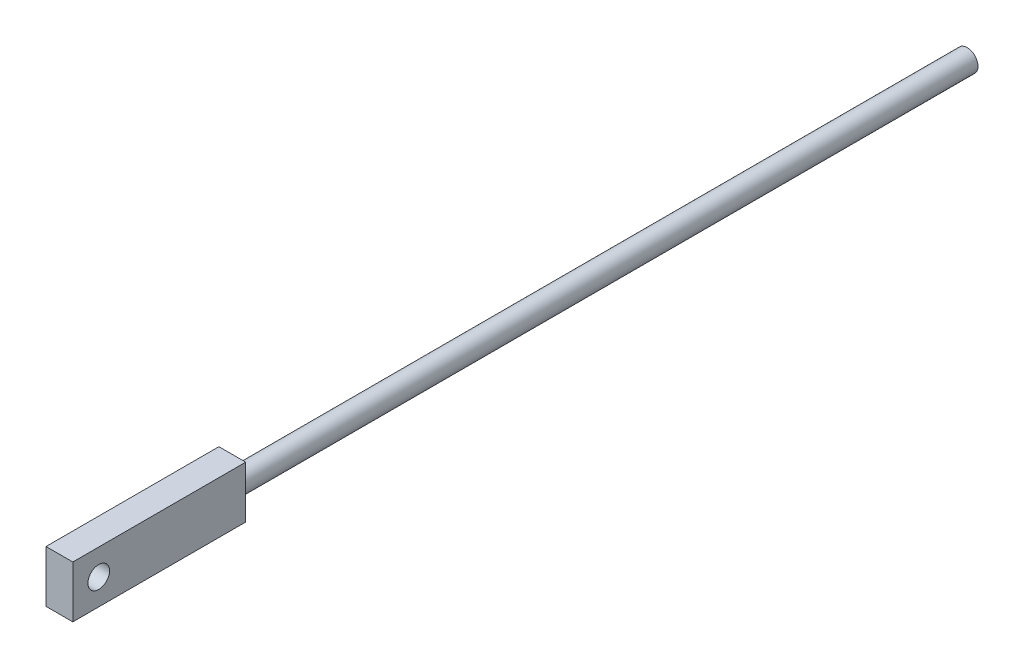
from build123d import *

# Parameters (mm, degrees)
SKETCH_1_W          = 6.2
SKETCH_1_H          = 12
EXTRUDE_1_DEPTH     = 40
SKETCH_2_R          = 2.5
CUT_EXTRUDE_1_DEPTH = 41.919921799
SKETCH_3_R          = 2.5
EXTRUDE_2_DEPTH     = 170


with BuildPart() as part:
    # 草图1 → 凸台-拉伸1 (new body)
    with BuildSketch(Plane.XY):
        Rectangle(SKETCH_1_W, SKETCH_1_H)
    extrude(amount=EXTRUDE_1_DEPTH)

    # 草图2 → 切除-拉伸1 (cut, through all)
    with BuildSketch(Plane(origin=(3.1, 0, 0), x_dir=(0, 0, -1), z_dir=(1, 0, 0))):
        with Locations((-34, 0)):
            Circle(SKETCH_2_R)
    extrude(amount=-CUT_EXTRUDE_1_DEPTH, mode=Mode.SUBTRACT)

    # 草图3 → 凸台-拉伸2 (add)
    with BuildSketch(Plane(origin=(0, 0, 0), x_dir=(-1, 0, 0), z_dir=(0, 0, -1))):
        Circle(SKETCH_3_R)
    extrude(amount=EXTRUDE_2_DEPTH)


solid = part.part
